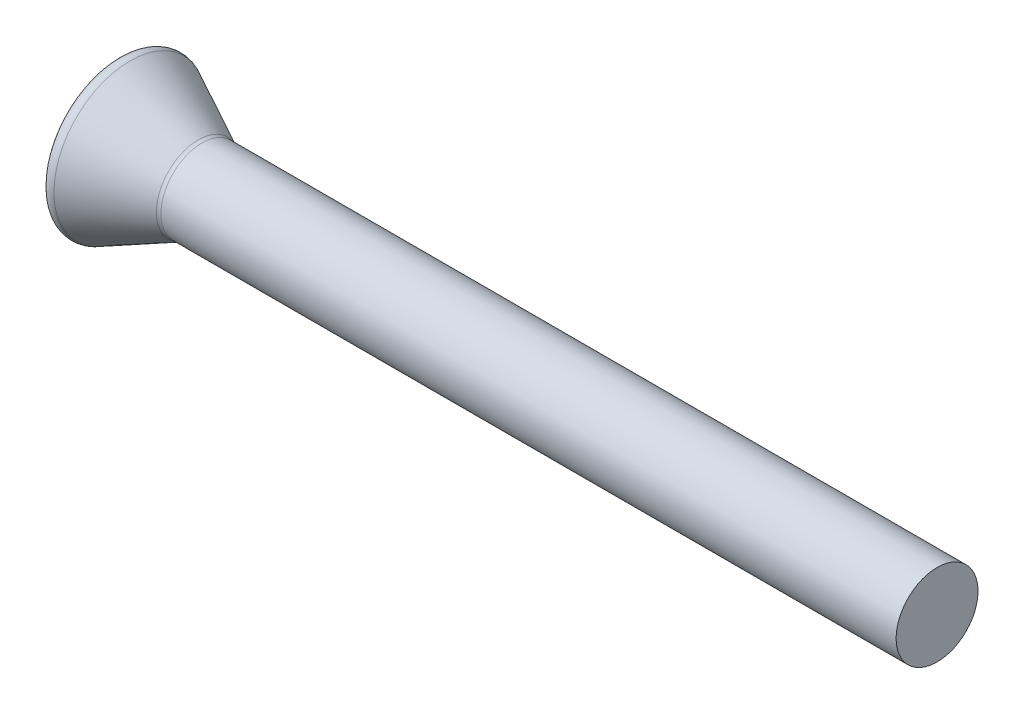
from build123d import *

# Parameters (mm, degrees)
FILLET_1_R = 0.1


with BuildPart() as part:
    # 草图1 → 旋转1 (revolve)
    with BuildSketch(Plane.XY):
        Polygon((0, 0), (0, 1), (1, 0.5), (10, 0.5), (10, 0), align=None)
    revolve(axis=Axis((10, 0, 0), (-1, 0, 0)))

    # 圆角1
    fillet_1_edges = [part.edges().sort_by_distance(p)[0] for p in [
        (1, -0.5, 0),
        (0, -1, 0),
    ]]
    fillet(fillet_1_edges, radius=FILLET_1_R)


solid = part.part
